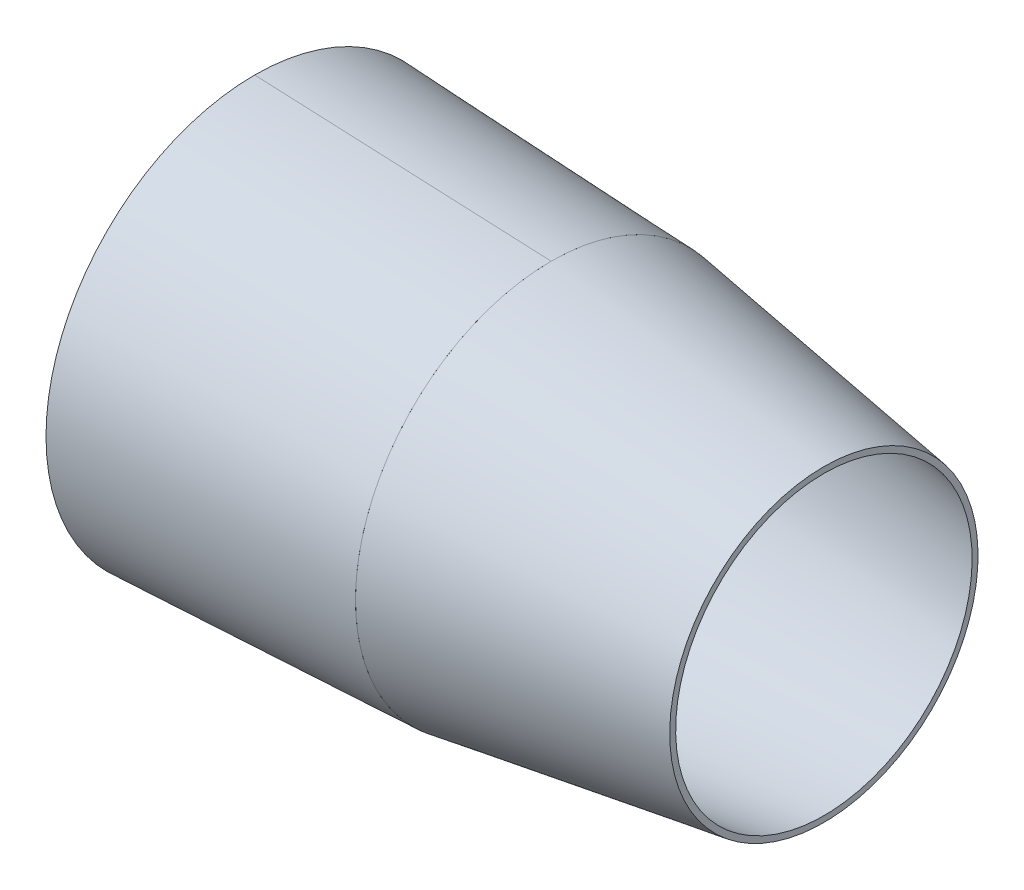
from build123d import *

# Parameters (mm, degrees)
REVOLVE1_ANGLE = 179.99999693
REVOLVE2_ANGLE = 179.99999693
REVOLVE3_ANGLE = 359.999999589


with BuildPart() as part:
    # Sketch1 → Revolve1 (revolve)
    with BuildSketch(Plane.XY):
        Polygon((700, 1720), (700, 1760), (3200, 1650), (3200, 1610), align=None)
    revolve(axis=Axis((0, 0, 0), (1, 0, 0)), revolution_arc=REVOLVE1_ANGLE)


with BuildPart() as body_2:
    # Sketch2 → Revolve2 (revolve)
    with BuildSketch(Plane.XY):
        Polygon((700, -1720), (700, -1760), (3200, -1650), (3200, -1610), align=None)
    revolve(axis=Axis((0, 0, 0), (1, 0, 0)), revolution_arc=REVOLVE2_ANGLE)


with BuildPart() as body_3:
    # Sketch3 → Revolve3 (revolve)
    with BuildSketch(Plane.XY):
        Polygon((3200, 1550), (3200, 1650), (5500, 1300), (5500, 1250), align=None)
    revolve(axis=Axis((0, 0, 0), (1, 0, 0)), revolution_arc=REVOLVE3_ANGLE)


solid = Compound([part.part, body_2.part, body_3.part])
